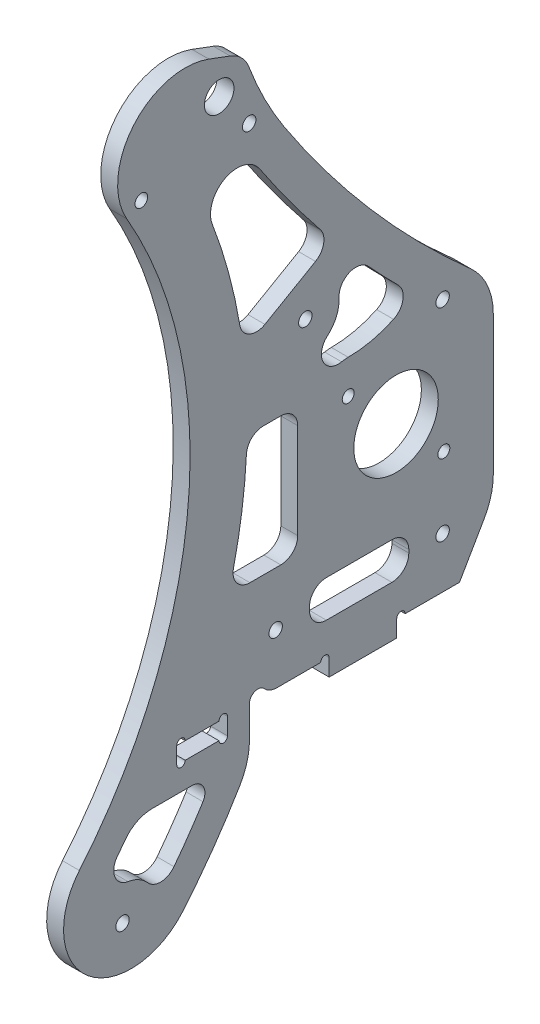
from build123d import *

# Parameters (mm, degrees)
SKETCH2_R                  = 5.5499
BOSS_EXTRUDE1_DEPTH        = 3.175
CUT_EXTRUDE1_DEPTH         = 3.175
CUT_EXTRUDE6_DEPTH         = 331.886967859
CUT_EXTRUDE6_DEPTH_BACK    = 331.886967859
SKETCH32_R                 = 2.38125
CUT_EXTRUDE4_DEPTH         = 331.886967859
F_1_1_DIAMETER_HOLE1_D     = 31.75
F_8_CLEARANCE_HOLE1_D      = 4.4958
FILLET1_R                  = 25.4
FILLET2_R                  = 6.35
CUT_EXTRUDE7_START         = -1.74625
SKETCH34_R                 = 3.968749998
SKETCH34_R_2               = 3.96875
SKETCH34_R_3               = 3.968749996
CUT_EXTRUDE7_DEPTH         = 1.74625
F_8_0_199_DIAMETER_HOLE1_D = 5.0546
CUT_EXTRUDE9_DEPTH         = 331.886967859


with BuildPart() as part:
    # Sketch2 → Boss-Extrude1 (new, symmetric)
    with BuildSketch(Plane(origin=(0, 0, 0), x_dir=(0, 0, -1), z_dir=(1, 0, 0))):
        with BuildLine():
            Line((184.861603477, 125.395219788), (192.888179376, 122.398060471))
            ThreePointArc((192.888179376, 122.398060471), (197.134402772, 119.670037319), (199.868014027, 115.427409246))
            ThreePointArc((199.868014027, 115.427409246), (205.79135088, 101.944347228), (213.165326628, 89.196666555))
            ThreePointArc((213.165326628, 89.196666555), (245.495612564, 46.296629776), (283.201634595, 8.035468699))
            ThreePointArc((283.201634595, 8.035468699), (289.498729419, -0.543862964), (291.728224202, -10.95))
            Line((291.728224202, -10.95), (291.728224202, -63.147045251))
            ThreePointArc((291.728224202, -63.147045251), (290.86274019, -69.721048996), (288.325269458, -75.847045251))
            Line((288.325269458, -75.847045251), (279.028224202, -91.949999995))
            Line((279.028224202, -91.949999995), (258.619227522, -91.949999995))
            ThreePointArc((258.619227522, -91.949999995), (257.031727522, -90.362499995), (255.444227522, -91.949999995))
            Line((255.444227522, -91.949999995), (255.444227522, -98.3))
            Line((255.444227522, -98.3), (230.044227522, -98.3))
            Line((230.044227522, -98.3), (230.044227522, -91.949999995))
            ThreePointArc((230.044227522, -91.949999995), (228.456727522, -90.362499995), (226.869227522, -91.949999995))
            Line((226.869227522, -91.949999995), (206.460230842, -91.949999995))
            ThreePointArc((206.460230842, -91.949999995), (203.285230842, -88.774999995), (200.110230842, -91.949999995))
            Line((200.110230842, -91.949999995), (200.110230842, -110.516313332))
            ThreePointArc((200.110230842, -110.516313332), (188.495902289, -129.333888909), (175.117759697, -146.941247574))
            ThreePointArc((175.117759697, -146.941247574), (139.333425556, -150.071971144), (136.202701987, -114.287637002))
            ThreePointArc((136.202701987, -114.287637002), (177.123417321, -15.496291061), (153.979316793, 88.9))
            ThreePointArc((153.979316793, 88.9), (156.586799992, 118.007464254), (184.861603477, 125.395219788))
        make_face()
        with Locations((188.725443767, 111.25)):
            Circle(SKETCH2_R, mode=Mode.SUBTRACT)
    extrude(amount=BOSS_EXTRUDE1_DEPTH, both=True)

    # Sketch4 → Cut-Extrude1 (cut)
    with BuildSketch(Plane.ZY.offset(3.175)):
        with BuildLine():
            ThreePointArc((-142.891227531, -119.899976319), (-139.536446205, -120.193481654), (-139.24294087, -116.838700328))
            ThreePointArc((-139.24294087, -116.838700328), (-180.470281158, -21.687694559), (-162.960405636, 80.521951489))
            ThreePointArc((-162.960405636, 80.521951489), (-164.040385384, 83.711676692), (-167.230110587, 82.631696943))
            ThreePointArc((-167.230110587, 82.631696943), (-185.19876014, -22.255931098), (-142.891227531, -119.899976319))
        make_face()
    extrude(amount=-CUT_EXTRUDE1_DEPTH, mode=Mode.SUBTRACT)

    # Sketch32 → Cut-Extrude6 (cut, two sides: drawn at the far end of the back side and taken through both)
    with BuildSketch(Plane.ZY.offset(3.175).offset(-CUT_EXTRUDE6_DEPTH_BACK)):
        with Locations((-159.478578107, 92.075)):
            Circle(SKETCH32_R)
    extrude(amount=CUT_EXTRUDE6_DEPTH + CUT_EXTRUDE6_DEPTH_BACK, mode=Mode.SUBTRACT)

    # Sketch23 → Cut-Extrude4 (cut, through all)
    with BuildSketch(Plane(origin=(3.175, 0, 0), x_dir=(0, 0, -1), z_dir=(1, 0, 0))):
        with BuildLine():
            Line((191.834020078, -91.95), (191.834020078, -98.3))
            ThreePointArc((191.834020078, -98.3), (190.246520078, -99.8875), (188.659020078, -98.3))
            Line((188.659020078, -98.3), (175.959020078, -98.3))
            ThreePointArc((175.959020078, -98.3), (174.371520078, -99.8875), (172.784020078, -98.3))
            Line((172.784020078, -98.3), (172.784020078, -91.95))
            ThreePointArc((172.784020078, -91.95), (174.371520078, -90.3625), (175.959020078, -91.95))
            Line((175.959020078, -91.95), (188.659020078, -91.95))
            ThreePointArc((188.659020078, -91.95), (190.246520078, -90.3625), (191.834020078, -91.95))
        make_face()
    extrude(amount=-CUT_EXTRUDE4_DEPTH, mode=Mode.SUBTRACT)

    # 1 (1) Diameter Hole1 (through all)
    with Locations(Plane(origin=(3.175, 0, 0), x_dir=(0, 0, -1), z_dir=(1, 0, 0))):
        with Locations((255.178224202, -28.45)):
            Hole(F_1_1_DIAMETER_HOLE1_D / 2)

    # #8 Clearance Hole1 (through all)
    with Locations(Plane.ZY.offset(3.175)):
        with Locations((-273.138736444, -46.410512242), (-237.21771196, -10.489487758)):
            Hole(F_8_CLEARANCE_HOLE1_D / 2)

    # Fillet1
    fillet1_edges = [part.edges().sort_by_distance(p)[0] for p in [
        (0, -110.516313332, -200.110230842),
    ]]
    fillet(fillet1_edges, radius=FILLET1_R)

    # Fillet2
    fillet2_edges = [part.edges().sort_by_distance(p)[0] for p in [
        (0, -91.949999995, -206.460230842),
    ]]
    fillet(fillet2_edges, radius=FILLET2_R)

    # Sketch34 → Cut-Extrude7 (cut)
    with BuildSketch(Plane.ZY.offset(3.175).offset(CUT_EXTRUDE7_START)):
        with Locations((-272.678224202, -72.899999995)):
            Circle(SKETCH34_R)
        with Locations((-272.678224202, 3.300000005)):
            Circle(SKETCH34_R)
        with Locations((-209.953929472, -72.899999995)):
            Circle(SKETCH34_R_2)
        with Locations((-221.091752478, 22.660527049)):
            Circle(SKETCH34_R)
        with Locations((-200.007931611, 96.911762922)):
            Circle(SKETCH34_R_3)
        with Locations((-152.402488977, -139.565014501)):
            Circle(SKETCH34_R_2)
    extrude(amount=CUT_EXTRUDE7_DEPTH, mode=Mode.SUBTRACT)

    # #8 (0.199) Diameter Hole1 (through all)
    with Locations(Plane(origin=(3.175, 0, 0), x_dir=(0, 0, -1), z_dir=(1, 0, 0))):
        with Locations((272.678224202, -72.899999995), (209.953929472, -72.899999995), (221.091752478, 22.660527049), (200.007931611, 96.911762922), (272.678224202, 3.300000005), (152.402488977, -139.565014501)):
            Hole(F_8_0_199_DIAMETER_HOLE1_D / 2)

    # Sketch38 → Cut-Extrude9 (cut, through all)
    with BuildSketch(Plane(origin=(3.175, 0, 0), x_dir=(0, 0, -1), z_dir=(1, 0, 0))):
        with BuildLine():
            Line((205.914798647, 28.562805507), (224.924360785, 39.537981324))
            ThreePointArc((224.924360785, 39.537981324), (227.99131211, 43.870819192), (226.69603004, 49.018820627))
            ThreePointArc((226.69603004, 49.018820627), (214.944800076, 64.327050851), (203.910748393, 80.160023463))
            ThreePointArc((203.910748393, 80.160023463), (190.936466062, 83.542932982), (186.142659774, 71.021131989))
            ThreePointArc((186.142659774, 71.021131989), (192.251844092, 52.271592857), (196.477565484, 33.009956649))
            ThreePointArc((196.477565484, 33.009956649), (200.032947992, 28.317899385), (205.914798647, 28.562805507))
        make_face()
        with BuildLine():
            Line((205.310000647, -4.207176979), (211.8854012, -4.207176979))
            ThreePointArc((211.8854012, -4.207176979), (216.375529261, -6.067048919), (218.2354012, -10.557176979))
            Line((218.2354012, -10.557176979), (218.2354012, -46.34282301))
            ThreePointArc((218.2354012, -46.34282301), (216.375529261, -50.832951071), (211.8854012, -52.69282301))
            Line((211.8854012, -52.69282301), (200.289772847, -52.69282301))
            ThreePointArc((200.289772847, -52.69282301), (195.319253016, -50.294586238), (194.103216157, -44.911384462))
            ThreePointArc((194.103216157, -44.911384462), (197.299266335, -27.67833955), (198.968379006, -10.23108657))
            ThreePointArc((198.968379006, -10.23108657), (200.936682347, -5.953201844), (205.310000647, -4.207176979))
        make_face()
        with BuildLine():
            Line((229.003929472, -65.39282301), (253.628224202, -65.39282301))
            ThreePointArc((253.628224202, -65.39282301), (258.118352263, -67.25269495), (259.978224202, -71.74282301))
            Line((259.978224202, -71.74282301), (259.978224202, -72.899999995))
            ThreePointArc((259.978224202, -72.899999995), (258.118352263, -77.390128055), (253.628224202, -79.249999995))
            Line((253.628224202, -79.249999995), (229.003929472, -79.249999995))
            ThreePointArc((229.003929472, -79.249999995), (224.513801412, -77.390128055), (222.653929472, -72.899999995))
            Line((222.653929472, -72.899999995), (222.653929472, -71.74282301))
            ThreePointArc((222.653929472, -71.74282301), (224.513801412, -67.25269495), (229.003929472, -65.39282301))
        make_face()
        with BuildLine():
            Line((178.614385619, -107.825), (163.596957108, -107.825))
            ThreePointArc((163.596957108, -107.825), (157.868812502, -109.190170518), (153.372147289, -112.9921875))
            ThreePointArc((153.372147289, -112.9921875), (151.919142792, -114.938348924), (150.441444733, -116.865827797))
            ThreePointArc((150.441444733, -116.865827797), (149.54669032, -123.085290269), (154.438269364, -127.02924176))
            ThreePointArc((154.438269364, -127.02924176), (158.545587593, -128.449604505), (161.93353243, -131.171611694))
            ThreePointArc((161.93353243, -131.171611694), (166.924642658, -133.320901925), (171.750540646, -130.822634844))
            ThreePointArc((171.750540646, -130.822634844), (177.370609198, -123.095397934), (182.643281535, -115.127067669))
            ThreePointArc((182.643281535, -115.127067669), (182.784283536, -110.2867702), (178.614385619, -107.825))
        make_face()
        with BuildLine():
            ThreePointArc((229.352144485, 13.013977205), (232.770157357, 17.670050169), (233.772565242, 23.358372055))
            ThreePointArc((233.772565242, 23.358372055), (237.643482483, 29.557433307), (244.785557135, 28.00722998))
            ThreePointArc((244.785557135, 28.00722998), (250.350507009, 22.07652944), (256.029490766, 16.254930046))
            ThreePointArc((256.029490766, 16.254930046), (257.782536544, 10.684174236), (254.244609375, 6.037717399))
            ThreePointArc((254.244609375, 6.037717399), (245.943574881, 3.17910276), (237.21771196, 2.210512242))
            ThreePointArc((237.21771196, 2.210512242), (235.966501016, 2.148726957), (234.727464312, 1.96397227))
            ThreePointArc((234.727464312, 1.96397227), (227.77212485, 5.41294467), (229.352144485, 13.013977205))
        make_face()
    extrude(amount=-CUT_EXTRUDE9_DEPTH, mode=Mode.SUBTRACT)


solid = part.part
